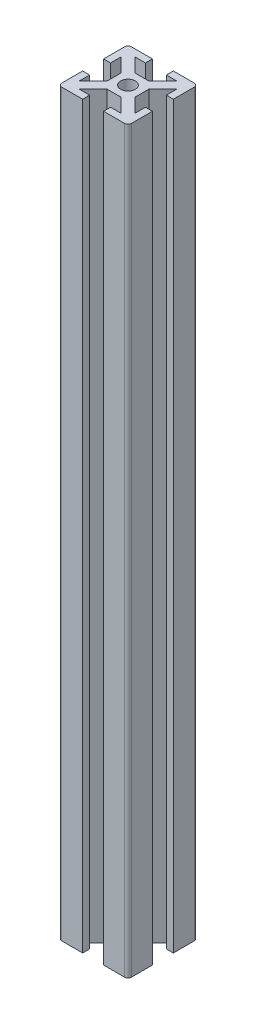
from build123d import *

# Parameters (mm, degrees)
SKETCH_1_R          = 2.1
EXTRUDE_1_DEPTH     = 650
FILLET_1_R          = 1
SKETCH_4_W          = 20.710237558
SKETCH_4_H          = 20.933829866
CUT_EXTRUDE_1_DEPTH = 438


with BuildPart() as part:
    # 草图1 → 凸台-拉伸1 (new body)
    with BuildSketch(Plane(origin=(0, 0, 0), x_dir=(1, 0, 0), z_dir=(0, 1, 0))):
        Polygon((10, 10), (3, 10), (3, 8), (6, 8), (2, 4), (-2, 4), (-6, 8), (-3, 8), (-3, 10), (-10, 10), (-10, 3), (-8, 3), (-8, 6), (-4, 2), (-4, -2), (-8, -6), (-8, -3), (-10, -3), (-10, -10), (-3, -10), (-3, -8), (-6, -8), (-2, -4), (2, -4), (6, -8), (3, -8), (3, -10), (10, -10), (10, -3), (8, -3), (8, -6), (4, -2), (4, 2), (8, 6), (8, 3), (10, 3), align=None)
        with Locations(Location((0, 0, 0), (0, 0, 270))):
            Circle(SKETCH_1_R, mode=Mode.SUBTRACT)
    extrude(amount=EXTRUDE_1_DEPTH)

    # 圆角1
    fillet_1_edges = [part.edges().sort_by_distance(p)[0] for p in [
        (10, 325, 10),
        (-10, 325, 10),
        (-10, 325, -10),
        (10, 325, -10),
    ]]
    fillet(fillet_1_edges, radius=FILLET_1_R)

    # 草图4 → 切除-拉伸1 (cut)
    with BuildSketch(Plane(origin=(0, 650, 0), x_dir=(1, 0, 0), z_dir=(0, 1, 0))):
        Rectangle(SKETCH_4_W, SKETCH_4_H)
    extrude(amount=-CUT_EXTRUDE_1_DEPTH, mode=Mode.SUBTRACT)


solid = part.part
